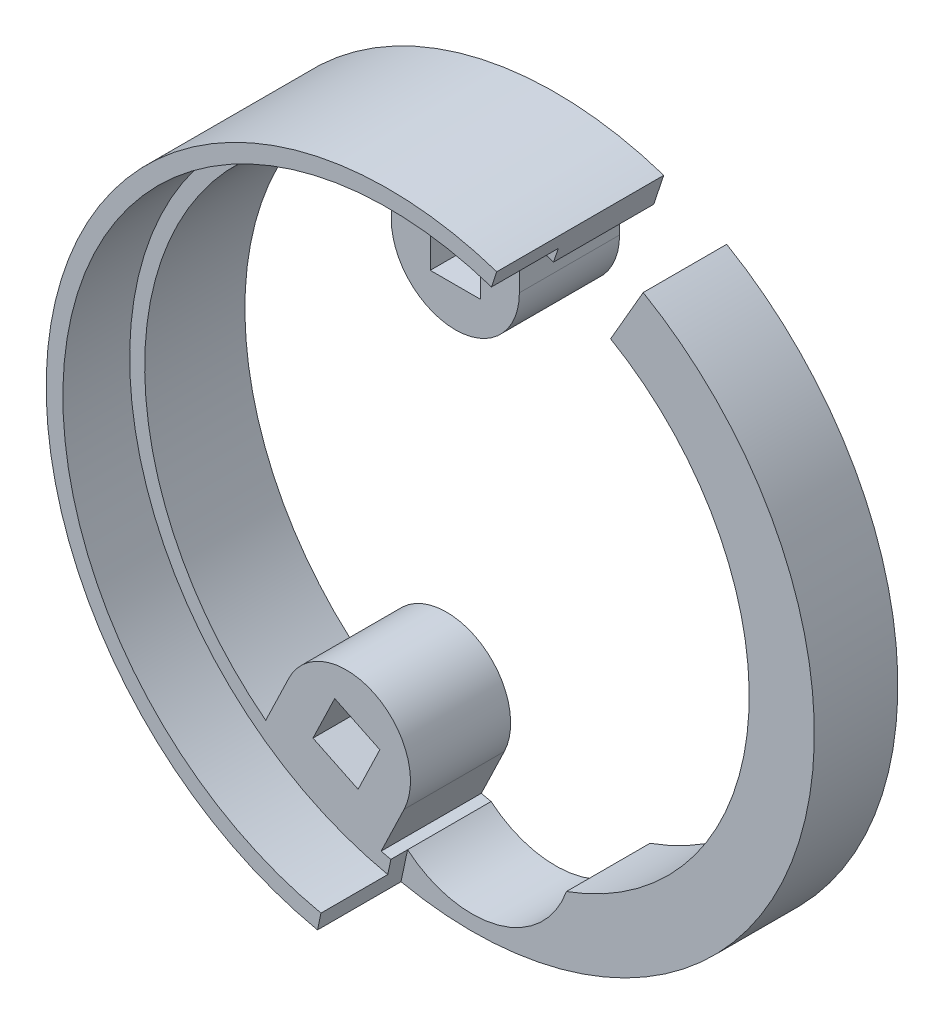
from build123d import *
from build123d.topology import SkipClean

# Parameters (mm, degrees)
RESSALTO_EXTRUS_O2_DEPTH = 6
CORTE_EXTRUS_O1_START    = -1
CORTE_EXTRUS_O1_DEPTH    = 1
ESBO_O8_W                = 3
ESBO_O8_H                = 3
RESSALTO_EXTRUS_O4_DEPTH = 6
RESSALTO_EXTRUS_O5_DEPTH = 4


with BuildPart() as part:
    # Esboço4 → Ressalto-extrusão2 (new body)
    with BuildSketch(Plane.XY):
        with BuildLine():
            Line((10.25, 17.753520778), (8.3, 14.376021703))
            ThreePointArc((8.3, 14.376021703), (16.535747837, -1.45912421), (5.654249214, -15.607352941))
            ThreePointArc((5.654249214, -15.607352941), (1.575368798, -19.389491614), (-3.857534027, -18.195588235))
            ThreePointArc((-3.857534027, -18.195588235), (-17.949080324, 4.877552207), (5.882044961, 17.645439838))
            Line((5.882044961, 17.645439838), (6.482899016, 19.447931004))
            ThreePointArc((6.482899016, 19.447931004), (-8.409235035, -18.695848901), (10.25, 17.753520778))
        make_face()
    extrude(amount=RESSALTO_EXTRUS_O2_DEPTH)

    # Esboço7 → Corte-extrusão1 (cut)
    with BuildSketch(Plane.XY.offset(6).offset(CORTE_EXTRUS_O1_START)):
        with BuildLine():
            Line((-3.857534027, -18.195588235), (-4.251583202, -20.054277356))
            ThreePointArc((-4.251583202, -20.054277356), (19.140340931, -7.341481393), (10.25, 17.753520778))
            Line((10.25, 17.753520778), (8.3, 14.376021703))
            ThreePointArc((8.3, 14.376021703), (16.535747837, -1.45912421), (5.654249214, -15.607352941))
            ThreePointArc((5.654249214, -15.607352941), (1.575368798, -19.389491614), (-3.857534027, -18.195588235))
        make_face()
    extrude(amount=CORTE_EXTRUS_O1_DEPTH, mode=Mode.SUBTRACT)

    # Esboço8 → Ressalto-extrusão4 (add)
    # profile 1 of 2: a face of its own
    with BuildSketch(Plane(origin=(0, 0, 0), x_dir=(-1, 0, 0), z_dir=(0, 0, -1))):
        with BuildLine():
            ThreePointArc((9.976510425, -11.876705547), (4.856795522, -10.085239821), (3.065329796, -15.204954723))
            Line((3.065329796, -15.204954723), (5.002459987, -19.227447012))
            Line((5.002459987, -19.227447012), (11.913640616, -15.899197835))
            Line((11.913640616, -15.899197835), (9.976510425, -11.876705547))
        make_face()
        Polygon((5.820292417, -15.543109046), (4.5186412, -12.840202442), (7.221547804, -11.538551224), (8.523199021, -14.241457828), align=None, mode=Mode.SUBTRACT)
    # profile 2 of 2: a face of its own
    with BuildSketch(Plane(origin=(0, 0, 0), x_dir=(-1, 0, 0), z_dir=(0, 0, -1))):
        with BuildLine():
            ThreePointArc((-3.835415892, 15.029187597), (0, 11.193771705), (3.835415892, 15.029187597))
            Line((3.835415892, 15.029187597), (3.835415892, 19.493817211))
            Line((3.835415892, 19.493817211), (-3.835415892, 19.493817211))
            Line((-3.835415892, 19.493817211), (-3.835415892, 15.029187597))
        make_face()
        with Locations((0, 15.029187597)):
            Rectangle(ESBO_O8_W, ESBO_O8_H, mode=Mode.SUBTRACT)
    extrude(amount=-RESSALTO_EXTRUS_O4_DEPTH)

    # Esboço9 → Ressalto-extrusão5 (add)
    with SkipClean():  # the faces are left unmerged after this step: merging them gives an invalid solid
        with BuildSketch(Plane.XY.offset(6)):
            with BuildLine():
                Line((-4.0441889, -19.076019924), (-4.251583202, -20.054277356))
                ThreePointArc((-4.251583202, -20.054277356), (-19.782588529, 5.375796787), (6.482899016, 19.447931004))
                Line((6.482899016, 19.447931004), (6.16666004, 18.499251443))
                ThreePointArc((6.16666004, 18.499251443), (-18.81758421, 5.113562798), (-4.0441889, -19.076019924))
            make_face()
        extrude(amount=RESSALTO_EXTRUS_O5_DEPTH)


solid = part.part
